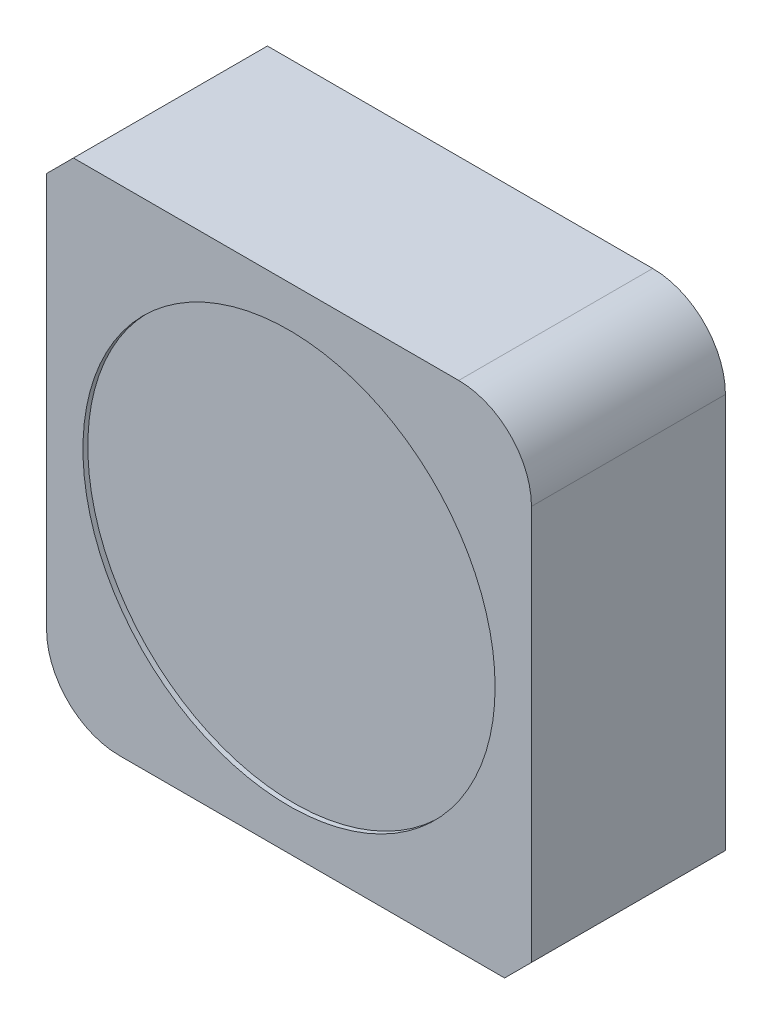
from build123d import *

# Parameters (mm, degrees)
EXTRUDE_1_DEPTH     = 4
FILLET_1_R          = 1.5
SKETCH_2_R          = 4.25
CUT_EXTRUDE_1_DEPTH = 0.1


with BuildPart() as part:
    # Эскиз1 → Бобышка-Вытянуть1 (new body)
    with BuildSketch(Plane.XY):
        Polygon((-5, 4.545941546), (-5, -5.1), (4.445941546, -5.1), (5, -4.545941546), (5, 5.1), (-4.445941546, 5.1), align=None)
    extrude(amount=EXTRUDE_1_DEPTH)

    # Скругление1
    fillet_1_edges = [part.edges().sort_by_distance(p)[0] for p in [
        (5, 5.1, 2),
        (-5, -5.1, 2),
    ]]
    fillet(fillet_1_edges, radius=FILLET_1_R)

    # Эскиз2 → Вырез-Вытянуть1 (cut)
    with BuildSketch(Plane.XY.offset(4)):
        Circle(SKETCH_2_R)
    extrude(amount=-CUT_EXTRUDE_1_DEPTH, mode=Mode.SUBTRACT)


solid = part.part
